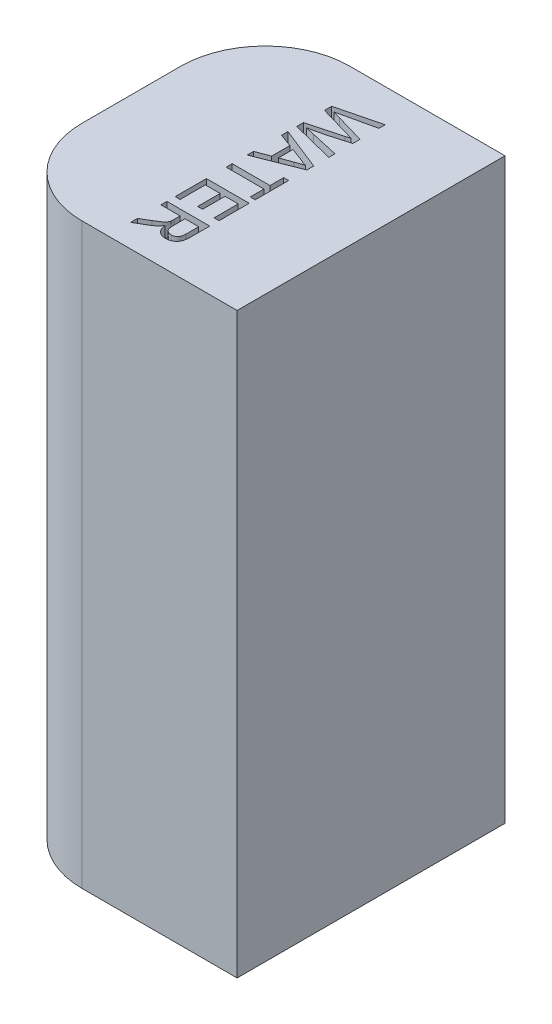
from build123d import *

# Parameters (mm, degrees)
SKETCH1_W           = 431.8
SKETCH1_H           = 482.6
BOSS_EXTRUDE1_DEPTH = 1041.4
FILLET1_R           = 152.4
CUT_EXTRUDE1_DEPTH  = 25.4


with BuildPart() as part:
    # Sketch1 → Boss-Extrude1 (new body)
    with BuildSketch(Plane(origin=(0, 0, 0), x_dir=(1, 0, 0), z_dir=(0, 1, 0))):
        Rectangle(SKETCH1_W, SKETCH1_H)
    extrude(amount=BOSS_EXTRUDE1_DEPTH)

    # Fillet1
    fillet1_edges = [part.edges().sort_by_distance(p)[0] for p in [
        (-215.9, 520.7, 241.3),
        (-215.9, 520.7, -241.3),
    ]]
    fillet(fillet1_edges, radius=FILLET1_R)

    # Sketch2 → Cut-Extrude1 (cut)
    # profile 1 of 5: a face of its own
    with BuildSketch(Plane(origin=(0, 1041.4, 0), x_dir=(1, 0, 0), z_dir=(0, 1, 0))):
        with BuildLine():
            Line((-17.486437911, 162.368959032), (59.563122636, 181.770260636))
            Line((59.563122636, 181.770260636), (59.563122636, 170.549300997))
            Line((59.563122636, 170.549300997), (8.891306274, 159.112256853))
            add(Edge.make_bspline(
                [(8.891306274, 159.112256853), (6.277956028, 158.519518091), (1.077935695, 157.340091944), (-4.124974357, 156.173479669), (-6.713081889, 155.593166348)],
                knots=[0, 0, 0, 0, 1.00513078, 2, 2, 2, 2], degree=3))
            add(Edge.make_bspline(
                [(-6.713081889, 155.593166348), (-5.782462476, 155.318406198), (-4.025622602, 154.799709102), (-1.535132784, 154.098531151), (0.638497481, 153.461673684), (2.505401329, 152.919103807), (4.068201652, 152.479787072), (5.307694834, 152.100485996), (6.2481542, 151.84195912), (6.766632568, 151.688755627), (6.977414947, 151.626472225)],
                knots=[0, 0, 0, 0, 1.633809233, 3.084334118, 4.356383392, 5.447555203, 6.357852567, 7.089694452, 7.629924063, 8, 8, 8, 8], degree=3))
            Line((6.977414947, 151.626472225), (59.563122636, 136.407949248))
            Line((59.563122636, 136.407949248), (59.563122636, 123.334836712))
            Line((59.563122636, 123.334836712), (20.961169325, 112.329961577))
            add(Edge.make_bspline(
                [(20.961169325, 112.329961577), (18.576492047, 111.722645712), (13.874424546, 110.52515026), (6.870520824, 108.934084276), (0.036533225, 107.465581222), (-4.483405496, 106.619695888), (-6.713081889, 106.202422407)],
                knots=[0, 0, 0, 0, 1.04154457, 2.053700482, 3.039894486, 4, 4, 4, 4], degree=3))
            add(Edge.make_bspline(
                [(-6.713081889, 106.202422407), (-5.57099199, 105.944863146), (-3.168685947, 105.403105293), (0.624345815, 104.55466837), (4.78005948, 103.61235206), (7.677015653, 102.960704567), (9.184563816, 102.621593472)],
                knots=[0, 0, 0, 0, 0.862132589, 1.813435466, 2.862132822, 4, 4, 4, 4], degree=3))
            Line((9.184563816, 102.621593472), (59.563122636, 91.246287758))
            Line((59.563122636, 91.246287758), (59.563122636, 80.025328119))
            Line((59.563122636, 80.025328119), (-17.486437911, 99.442064331))
            Line((-17.486437911, 99.442064331), (-17.486437911, 111.388450521))
            Line((-17.486437911, 111.388450521), (41.39658963, 127.486746124))
            add(Edge.make_bspline(
                [(41.39658963, 127.486746124), (41.972225949, 127.648396201), (43.065720608, 127.955471155), (44.626174548, 128.357974499), (45.998529585, 128.757124917), (47.200521158, 129.074609715), (48.220036926, 129.349366226), (49.05409192, 129.59267487), (49.719009928, 129.749164447), (50.096929545, 129.86233044), (50.256054324, 129.909979499)],
                knots=[0, 0, 0, 0, 1.562239628, 2.967673567, 4.210417925, 5.296319877, 6.215971374, 6.969386481, 7.566055473, 8, 8, 8, 8], degree=3))
            add(Edge.make_bspline(
                [(50.256054324, 129.909979499), (49.246961739, 130.195680768), (47.340272675, 130.735515759), (44.656053544, 131.534986435), (42.29581137, 132.205826334), (40.835607225, 132.630952927), (40.161821031, 132.827120313)],
                knots=[0, 0, 0, 0, 1.197730334, 2.263121701, 3.198547257, 4, 4, 4, 4], degree=3))
            Line((40.161821031, 132.827120313), (-17.486437911, 149.511931))
            Line((-17.486437911, 149.511931), (-17.486437911, 162.368959032))
        make_face()
    # profile 2 of 5: a face of its own
    with BuildSketch(Plane(origin=(0, 1041.4, 0), x_dir=(1, 0, 0), z_dir=(0, 1, 0))):
        Polygon((-17.486437911, 83.652460877), (59.563122636, 53.061068849), (59.563122636, 40.805990509), (-17.486437911, 10.214598481), (-17.486437911, 21.744250269), (6.22111918, 30.511107319), (6.22111918, 63.355952039), (-17.486437911, 72.122809089), align=None)
        with BuildLine():
            Line((15.111453089, 60.083815253), (15.111453089, 33.783244105))
            Line((15.111453089, 33.783244105), (35.361658105, 41.269028733))
            add(Edge.make_bspline(
                [(35.361658105, 41.269028733), (36.14409843, 41.55600699), (37.673917002, 42.117103666), (39.896614243, 42.953867855), (42.007378773, 43.718322134), (43.975945251, 44.467932329), (45.830909084, 45.144618842), (47.559740831, 45.768338146), (49.150424284, 46.385191275), (50.178169696, 46.755373515), (50.672788726, 46.933529679)],
                knots=[0, 0, 0, 0, 1.225184869, 2.395467751, 3.491410812, 4.525364584, 5.492066482, 6.394148129, 7.227157926, 8, 8, 8, 8], degree=3))
            add(Edge.make_bspline(
                [(50.672788726, 46.933529679), (49.453101756, 47.228234362), (47.008698664, 47.818858888), (43.427320212, 49.055482845), (39.878695083, 50.470137703), (37.591985274, 51.619006013), (36.442080628, 52.19673083)],
                knots=[0, 0, 0, 0, 0.9891762, 1.982431084, 2.985436691, 4, 4, 4, 4], degree=3))
            Line((36.442080628, 52.19673083), (15.111453089, 60.083815253))
        make_face(mode=Mode.SUBTRACT)
    # profile 3 of 5: a face of its own
    with BuildSketch(Plane(origin=(0, 1041.4, 0), x_dir=(1, 0, 0), z_dir=(0, 1, 0))):
        Polygon((-17.486437911, -16.780530004), (50.672788726, -16.780530004), (50.672788726, 7.914841966), (59.563122636, 7.914841966), (59.563122636, -52.341865641), (50.672788726, -52.341865641), (50.672788726, -27.646493671), (-17.486437911, -27.646493671), align=None)
    # profile 4 of 5: a face of its own
    with BuildSketch(Plane(origin=(0, 1041.4, 0), x_dir=(1, 0, 0), z_dir=(0, 1, 0))):
        Polygon((-17.486437911, -63.207829308), (59.563122636, -63.207829308), (59.563122636, -117.537647642), (50.672788726, -117.537647642), (50.672788726, -74.073792975), (26.965231635, -74.073792975), (26.965231635, -114.574203006), (18.074897726, -114.574203006), (18.074897726, -74.073792975), (-8.596104002, -74.073792975), (-8.596104002, -119.5132774), (-17.486437911, -119.5132774), align=None)
    # profile 5 of 5: a face of its own
    with BuildSketch(Plane(origin=(0, 1041.4, 0), x_dir=(1, 0, 0), z_dir=(0, 1, 0))):
        with BuildLine():
            Line((-17.486437911, -134.330500582), (59.563122636, -134.330500582))
            Line((59.563122636, -134.330500582), (59.563122636, -167.761860387))
            add(Edge.make_bspline(
                [(59.563122636, -167.761860387), (59.556983777, -168.549070293), (59.545102734, -170.072622929), (59.460203646, -172.282027707), (59.279835472, -174.339412851), (59.07838629, -176.257744899), (58.780942602, -178.033741243), (58.431987613, -179.66824846), (58.01956304, -181.154997244), (57.53206127, -182.505302119), (56.98070273, -183.758187198), (56.300054419, -184.919205419), (55.555439464, -186.038117205), (54.67355019, -187.070659468), (53.725280442, -188.062029616), (52.663751972, -188.978350505), (51.503956182, -189.824094123), (49.84586479, -190.867666227), (47.626339648, -191.965741822), (44.800555004, -192.902946681), (41.838450974, -193.502148696), (39.814854559, -193.566661435), (38.788140966, -193.59939331)],
                knots=[0, 0, 0, 0, 1.242122331, 2.403982386, 3.487329914, 4.500326623, 5.446523787, 6.327028739, 7.136568587, 7.878666205, 8.590811102, 9.292609518, 9.999600102, 10.708452415, 11.431798422, 12.162621657, 12.917616336, 13.694634159, 15.252079616, 16.810286496, 18.381632726, 20, 20, 20, 20], degree=3))
            add(Edge.make_bspline(
                [(38.788140966, -193.59939331), (38.129046761, -193.584315939), (36.827290509, -193.554537096), (34.913358318, -193.326431446), (33.084680941, -192.913683983), (31.325206317, -192.384445257), (29.659997742, -191.659972381), (28.054542933, -190.821080331), (26.554807926, -189.78036645), (25.110858136, -188.618278577), (23.78714369, -187.267271644), (22.565873002, -185.763384549), (21.510727182, -184.068767427), (20.562489658, -182.214604157), (19.732716592, -180.197530291), (19.035051766, -178.004132655), (18.488852309, -175.642177814), (18.215251037, -174.004220376), (18.074897726, -173.163973005)],
                knots=[0, 0, 0, 0, 0.98268397, 1.940868231, 2.867803148, 3.77529712, 4.675825539, 5.571570676, 6.471608834, 7.392971743, 8.331421822, 9.286283743, 10.275919943, 11.301762849, 12.388744527, 13.524158817, 14.729930953, 16, 16, 16, 16], degree=3))
            add(Edge.make_bspline(
                [(18.074897726, -173.163973005), (17.762767213, -173.785049333), (17.172015865, -174.960524536), (16.22360934, -176.581889954), (15.285052803, -177.974187754), (14.598747775, -178.777261945), (14.277984285, -179.152600708)],
                knots=[0, 0, 0, 0, 1.172410807, 2.218954047, 3.167579294, 4, 4, 4, 4], degree=3))
            add(Edge.make_bspline(
                [(14.277984285, -179.152600708), (13.565456203, -179.881694756), (12.104178441, -181.376946586), (9.592111732, -183.417412997), (6.829557323, -185.436430188), (4.816433057, -186.648605944), (3.782451198, -187.271204243)],
                knots=[0, 0, 0, 0, 0.918170575, 1.883016652, 2.912673989, 4, 4, 4, 4], degree=3))
            Line((3.782451198, -187.271204243), (-17.486437911, -199.91214777))
            Line((-17.486437911, -199.91214777), (-17.486437911, -187.456419533))
            Line((-17.486437911, -187.456419533), (-1.218361626, -177.856093679))
            add(Edge.make_bspline(
                [(-1.218361626, -177.856093679), (-0.647586216, -177.510899979), (0.458482809, -176.841971269), (2.074000933, -175.875960395), (3.560771779, -174.927962119), (4.96385599, -174.051581808), (6.246772225, -173.199941115), (7.447792829, -172.42086475), (8.519440804, -171.654412), (9.810118139, -170.763017416), (11.214920618, -169.688312168), (12.649024307, -168.42571648), (13.820008652, -167.254164838), (14.951239529, -165.788394055), (16.005316737, -163.969571904), (16.495183321, -162.42674767), (16.732086875, -161.680625039)],
                knots=[0, 0, 0, 0, 1.130769053, 2.191244754, 3.190605808, 4.119719489, 4.995392299, 5.800890497, 6.546104885, 7.228445539, 8.4599972, 9.541354885, 10.466489475, 11.262010607, 12.675885558, 14, 14, 14, 14], degree=3))
            add(Edge.make_bspline(
                [(16.732086875, -161.680625039), (16.788564643, -161.367440764), (16.917505082, -160.652431677), (17.001716288, -159.438348031), (17.091095217, -157.967336748), (17.088491015, -156.901269803), (17.087082847, -156.324816243)],
                knots=[0, 0, 0, 0, 0.709978628, 1.620902492, 2.713552433, 4, 4, 4, 4], degree=3))
            Line((17.087082847, -156.324816243), (17.087082847, -145.196464249))
            Line((17.087082847, -145.196464249), (-17.486437911, -145.196464249))
            Line((-17.486437911, -145.196464249), (-17.486437911, -134.330500582))
        make_face()
        with BuildLine():
            Line((25.977416756, -145.196464249), (25.977416756, -165.832534451))
            add(Edge.make_bspline(
                [(25.977416756, -165.832534451), (25.993671616, -166.867291598), (26.024058551, -168.80167303), (26.281710761, -171.506799112), (26.695639396, -173.816358863), (27.289712278, -175.773460458), (28.118222124, -177.416825242), (29.147615333, -178.828630214), (30.400110196, -180.029679445), (31.840314782, -181.011267531), (33.411728115, -181.784390807), (35.074068477, -182.312171569), (36.791375413, -182.679873305), (37.962994825, -182.715419416), (38.556621853, -182.733429643)],
                knots=[0, 0, 0, 0, 1.545806995, 2.889741191, 4.055176196, 5.047087691, 5.934047151, 6.79198357, 7.645535072, 8.5133672, 9.386595861, 10.252007348, 11.114340652, 12, 12, 12, 12], degree=3))
            add(Edge.make_bspline(
                [(38.556621853, -182.733429643), (38.989112256, -182.719088608), (39.836233904, -182.690998733), (41.07957329, -182.543742315), (42.261033094, -182.257440878), (43.386858646, -181.879380532), (44.448804077, -181.374215193), (45.455098291, -180.774099379), (46.400163999, -180.05797595), (47.286880017, -179.237697767), (48.093704937, -178.295869346), (48.789819847, -177.22007987), (49.381367346, -176.018814027), (49.850858985, -174.690675543), (50.226375873, -173.239848294), (50.476195146, -171.658073043), (50.65696354, -169.952583584), (50.667415113, -168.770778293), (50.672788726, -168.163160181)],
                knots=[0, 0, 0, 0, 0.965208469, 1.890559848, 2.786986821, 3.67262109, 4.535197034, 5.405224191, 6.282113641, 7.175449223, 8.095446547, 9.040936516, 10.026471658, 11.075712529, 12.17809725, 13.364958037, 14.645208957, 16, 16, 16, 16], degree=3))
            Line((50.672788726, -168.163160181), (50.672788726, -145.196464249))
            Line((50.672788726, -145.196464249), (25.977416756, -145.196464249))
        make_face(mode=Mode.SUBTRACT)
    extrude(amount=-CUT_EXTRUDE1_DEPTH, mode=Mode.SUBTRACT)


solid = part.part
